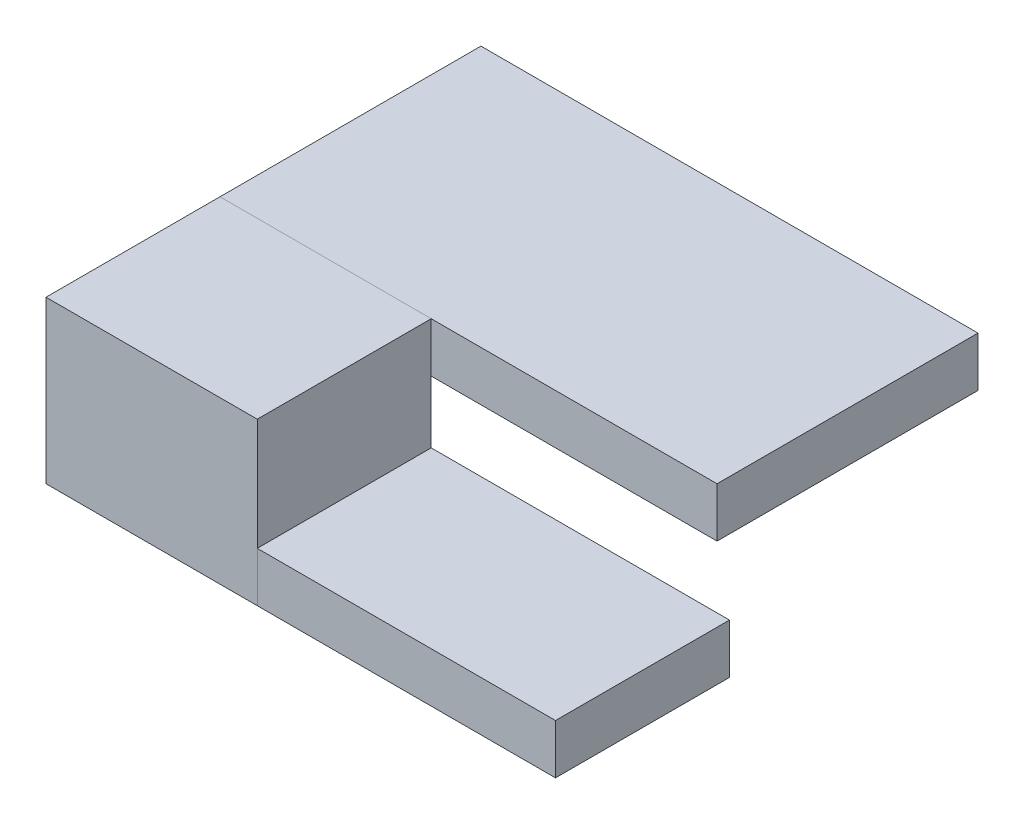
from build123d import *

# Parameters (mm, degrees)
ANCHOR_PLATE_START = 17
SKETCH1_W          = 14
SKETCH1_H          = 4
ANCHOR_PLATE_DEPTH = 24
SKETCH2_W          = 14
SKETCH2_H          = 13
COLUMN_DEPTH       = 17
SKETCH3_W          = 21
SKETCH3_H          = 4
FOOT_DEPTH         = 40


with BuildPart() as part:
    # Sketch1 → anchor_plate (new body)
    with BuildSketch(Plane(origin=(0, 0, 0), x_dir=(0, 0, -1), z_dir=(1, 0, 0)).offset(ANCHOR_PLATE_START)):
        with Locations((-498, -11)):
            Rectangle(SKETCH1_W, SKETCH1_H)
    extrude(amount=ANCHOR_PLATE_DEPTH)


with BuildPart() as body_2:
    # Sketch2 → column (new body)
    with BuildSketch(Plane(origin=(0, 0, 0), x_dir=(0, 0, -1), z_dir=(1, 0, 0))):
        with Locations((-498, -6.5)):
            Rectangle(SKETCH2_W, SKETCH2_H)
    extrude(amount=COLUMN_DEPTH)


with BuildPart() as body_3:
    # Sketch3 → foot (new body)
    with BuildSketch(Plane(origin=(0, 0, 0), x_dir=(0, 0, -1), z_dir=(1, 0, 0))):
        with Locations((-480.5, -2)):
            Rectangle(SKETCH3_W, SKETCH3_H)
    extrude(amount=FOOT_DEPTH)


solid = Compound([part.part, body_2.part, body_3.part])
